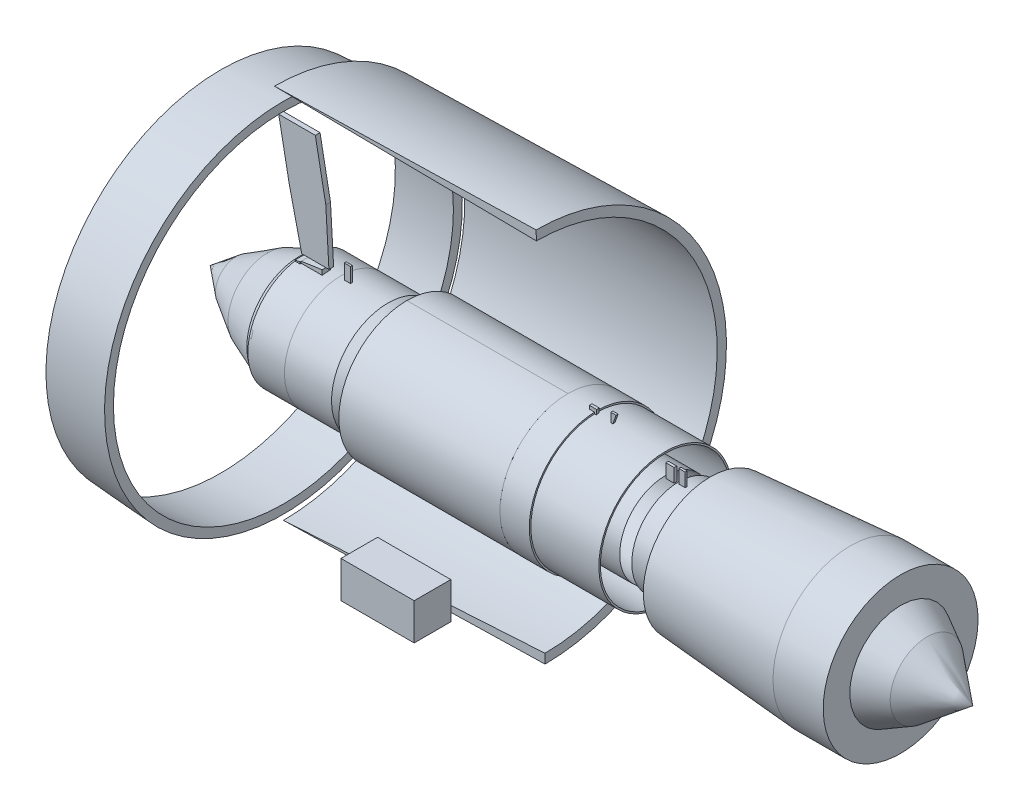
from build123d import *

# Parameters (mm, degrees)
REVOLVE1_ANGLE       = 359.999999589
SKETCH2_W            = 350
SKETCH2_H            = 320
REVOLVE2_ANGLE       = 359.999999589
BOSS_EXTRUDE1_DEPTH  = 80
BOSS_EXTRUDE2_DEPTH  = 45
BOSS_EXTRUDE3_DEPTH  = 90
REVOLVE3_ANGLE       = 359.999999589
REVOLVE5_ANGLE       = 359.999999589
SKETCH9_W            = 60
SKETCH9_H            = 180
BOSS_EXTRUDE5_DEPTH  = 18
SKETCH11_W           = 1500
SKETCH11_H           = 180
REVOLVE7_ANGLE       = 359.999999589
SKETCH12_W           = 50
SKETCH12_H           = 130
BOSS_EXTRUDE6_DEPTH  = 15
SKETCH13_W           = 1540
SKETCH13_H           = 70
REVOLVE8_ANGLE       = 179.99999693
SKETCH14_W           = 1540
SKETCH14_H           = 70
REVOLVE9_ANGLE       = 179.99999693
SKETCH15_W           = 280
SKETCH15_H           = 300
REVOLVE10_ANGLE      = 359.999999589
SKETCH16_W           = 650
SKETCH16_H           = 15
REVOLVE11_ANGLE      = 359.999999589
REVOLVE12_ANGLE      = 359.999999589
BOSS_EXTRUDE7_DEPTH  = 25
BOSS_EXTRUDE8_DEPTH  = 20
SKETCH20_W           = 80
SKETCH20_H           = 130
BOSS_EXTRUDE9_DEPTH  = 25
SKETCH21_W           = 270
SKETCH21_H           = 200
REVOLVE13_ANGLE      = 359.999999589
SKETCH22_W           = 60
SKETCH22_H           = 130
BOSS_EXTRUDE10_DEPTH = 20
REVOLVE14_ANGLE      = 359.999999589
SKETCH24_W           = 70
SKETCH24_H           = 170
BOSS_EXTRUDE11_DEPTH = 20
REVOLVE15_ANGLE      = 359.999999589
SKETCH26_W           = 480
SKETCH26_H           = 440
REVOLVE16_ANGLE      = 359.999999589
REVOLVE17_ANGLE      = 359.999999589
SKETCH32_W           = 700
SKETCH32_H           = 350
BOSS_EXTRUDE12_DEPTH = 350
REVOLVE23_ANGLE      = 179.99999693


with BuildPart() as part:
    # Sketch1 → Revolve1 (revolve)
    with BuildSketch(Plane.XY):
        Polygon((0, 0), (250, 200), (550, 380), (850, 500), (900, 540), (920, 540), (920, 460), (850, 460), (550, 350), (250, 170), (50, 0), align=None)
    revolve(axis=Axis((0, 0, 0), (1, 0, 0)), revolution_arc=REVOLVE1_ANGLE)


with BuildPart() as body_2:
    # Sketch2 → Revolve2 (revolve)
    with BuildSketch(Plane.XY):
        with Locations((1075, 380)):
            Rectangle(SKETCH2_W, SKETCH2_H)
    revolve(axis=Axis((0, 0, 0), (1, 0, 0)), revolution_arc=REVOLVE2_ANGLE)


with BuildPart() as body_3:
    # Sketch3 → Boss-Extrude1 (new body)
    with BuildSketch(Plane.XY):
        Polygon((950, 500), (950, 550), (1150, 580), (1150, 500), align=None)
    extrude(amount=BOSS_EXTRUDE1_DEPTH)


with BuildPart() as body_4:
    # Sketch4 → Boss-Extrude2 (new body)
    with BuildSketch(Plane.XY):
        Polygon((920, 580), (800, 1100), (700, 1625), (1050, 1625), (1150, 1100), (1180, 580), align=None)
    extrude(amount=BOSS_EXTRUDE2_DEPTH)


with BuildPart() as body_5:
    # Sketch5 → Boss-Extrude3 (new body)
    with BuildSketch(Plane.XY):
        Polygon((900, 490), (900, 540), (950, 550), (950, 490), align=None)
    extrude(amount=BOSS_EXTRUDE3_DEPTH)


with BuildPart() as body_6:
    # Sketch6 → Revolve3 (revolve)
    with BuildSketch(Plane.XY):
        Polygon((100, 1670), (700, 1710), (700, 1625), align=None)
    revolve(axis=Axis((0, 0, 0), (1, 0, 0)), revolution_arc=REVOLVE3_ANGLE)


with BuildPart() as body_7:
    # Sketch8 → Revolve5 (revolve)
    with BuildSketch(Plane.XY):
        Polygon((1250, 250), (1250, 540), (1400, 540), (1550, 540), (1700, 540), (1850, 470), (1850, 250), align=None)
    revolve(axis=Axis((0, 0, 0), (1, 0, 0)), revolution_arc=REVOLVE5_ANGLE)


with BuildPart() as body_8:
    # Sketch9 → Boss-Extrude5 (new body)
    with BuildSketch(Plane.XY):
        with Locations((1330, 590)):
            Rectangle(SKETCH9_W, SKETCH9_H)
    extrude(amount=BOSS_EXTRUDE5_DEPTH)


with BuildPart() as body_9:
    # Sketch11 → Revolve7 (revolve)
    with BuildSketch(Plane.XY):
        with Locations((2650, 370)):
            Rectangle(SKETCH11_W, SKETCH11_H)
    revolve(axis=Axis((0, 0, 0), (1, 0, 0)), revolution_arc=REVOLVE7_ANGLE)


with BuildPart() as body_10:
    # Sketch12 → Boss-Extrude6 (new body)
    with BuildSketch(Plane.XY):
        with Locations((2025, 515)):
            Rectangle(SKETCH12_W, SKETCH12_H)
    extrude(amount=BOSS_EXTRUDE6_DEPTH)


with BuildPart() as body_11:
    # Sketch13 → Revolve8 (revolve)
    with BuildSketch(Plane.XY):
        with Locations((2650, 615)):
            Rectangle(SKETCH13_W, SKETCH13_H)
    revolve(axis=Axis((0, 0, 0), (1, 0, 0)), revolution_arc=REVOLVE8_ANGLE)


with BuildPart() as body_12:
    # Sketch14 → Revolve9 (revolve)
    with BuildSketch(Plane.XY):
        with Locations((2650, -615)):
            Rectangle(SKETCH14_W, SKETCH14_H)
    revolve(axis=Axis((0, 0, 0), (1, 0, 0)), revolution_arc=REVOLVE9_ANGLE)


with BuildPart() as body_13:
    # Sketch15 → Revolve10 (revolve)
    with BuildSketch(Plane.XY):
        with Locations((3560, 500)):
            Rectangle(SKETCH15_W, SKETCH15_H)
    revolve(axis=Axis((0, 0, 0), (1, 0, 0)), revolution_arc=REVOLVE10_ANGLE)


with BuildPart() as body_14:
    # Sketch16 → Revolve11 (revolve)
    with BuildSketch(Plane.XY):
        with Locations((4025, 627.5)):
            Rectangle(SKETCH16_W, SKETCH16_H)
    revolve(axis=Axis((0, 0, 0), (1, 0, 0)), revolution_arc=REVOLVE11_ANGLE)


with BuildPart() as body_15:
    # Sketch17 → Revolve12 (revolve)
    with BuildSketch(Plane.XY):
        Polygon((3700, 420), (3700, 435), (4350, 435), align=None)
    revolve(axis=Axis((0, 0, 0), (1, 0, 0)), revolution_arc=REVOLVE12_ANGLE)


with BuildPart() as body_16:
    # Sketch18 → Boss-Extrude7 (new body)
    with BuildSketch(Plane.XY):
        Polygon((3650, 500), (3650, 680), (3720, 680), (3700, 500), align=None)
    extrude(amount=BOSS_EXTRUDE7_DEPTH)


with BuildPart() as body_17:
    # Sketch19 → Boss-Extrude8 (new body)
    with BuildSketch(Plane.XY):
        Polygon((3850, 580), (3850, 720), (3900, 720), align=None)
    extrude(amount=BOSS_EXTRUDE8_DEPTH)


with BuildPart() as body_18:
    # Sketch20 → Boss-Extrude9 (new body)
    with BuildSketch(Plane.XY):
        with Locations((4420, 505)):
            Rectangle(SKETCH20_W, SKETCH20_H)
    extrude(amount=BOSS_EXTRUDE9_DEPTH)


with BuildPart() as body_19:
    # Sketch21 → Revolve13 (revolve)
    with BuildSketch(Plane.XY):
        with Locations((4615, 350)):
            Rectangle(SKETCH21_W, SKETCH21_H)
    revolve(axis=Axis((0, 0, 0), (1, 0, 0)), revolution_arc=REVOLVE13_ANGLE)


with BuildPart() as body_20:
    # Sketch22 → Boss-Extrude10 (new body)
    with BuildSketch(Plane.XY):
        with Locations((4530, 515)):
            Rectangle(SKETCH22_W, SKETCH22_H)
    extrude(amount=BOSS_EXTRUDE10_DEPTH)


with BuildPart() as body_21:
    # Sketch23 → Revolve14 (revolve)
    with BuildSketch(Plane.XY):
        Polygon((4800, 250), (4800, 460), (6100, 550), (6100, 250), align=None)
    revolve(axis=Axis((0, 0, 0), (1, 0, 0)), revolution_arc=REVOLVE14_ANGLE)


with BuildPart() as body_22:
    # Sketch24 → Boss-Extrude11 (new body)
    with BuildSketch(Plane.XY):
        with Locations((5235, 575)):
            Rectangle(SKETCH24_W, SKETCH24_H)
    extrude(amount=BOSS_EXTRUDE11_DEPTH)


with BuildPart() as body_23:
    # Sketch25 → Revolve15 (revolve)
    with BuildSketch(Plane.XY):
        Polygon((4780, 580), (4780, 640), (6120, 740), (6120, 670), align=None)
    revolve(axis=Axis((0, 0, 0), (1, 0, 0)), revolution_arc=REVOLVE15_ANGLE)


with BuildPart() as body_24:
    # Sketch26 → Revolve16 (revolve)
    with BuildSketch(Plane.XY):
        with Locations((6360, 520)):
            Rectangle(SKETCH26_W, SKETCH26_H)
    revolve(axis=Axis((0, 0, 0), (1, 0, 0)), revolution_arc=REVOLVE16_ANGLE)


with BuildPart() as body_25:
    # Sketch27 → Revolve17 (revolve)
    with BuildSketch(Plane.XY):
        Polygon((6300, 350), (6300, 650), (6850, 350), (7290, 0), (6300, 0), align=None)
    revolve(axis=Axis((0, 0, 0), (1, 0, 0)), revolution_arc=REVOLVE17_ANGLE)


with BuildPart() as body_26:
    # Sketch32 → Boss-Extrude12 (new body)
    with BuildSketch(Plane.XY):
        with Locations((1950, -1625)):
            Rectangle(SKETCH32_W, SKETCH32_H)
    extrude(amount=BOSS_EXTRUDE12_DEPTH)


with BuildPart() as body_27:
    # Sketch34 → Revolve23 (revolve)
    with BuildSketch(Plane.XY):
        Polygon((700, -1760), (3201.197797342, -1699.608161176), (3200, -1610), align=None)
    revolve(axis=Axis((0, 0, 0), (0.9997086328440268, 0.02413813201403536, 0)), revolution_arc=REVOLVE23_ANGLE)


solid = Compound([part.part, body_2.part, body_3.part, body_4.part, body_5.part, body_6.part, body_7.part, body_8.part, body_9.part, body_10.part, body_11.part, body_12.part, body_13.part, body_14.part, body_15.part, body_16.part, body_17.part, body_18.part, body_19.part, body_20.part, body_21.part, body_22.part, body_23.part, body_24.part, body_25.part, body_26.part, body_27.part])
